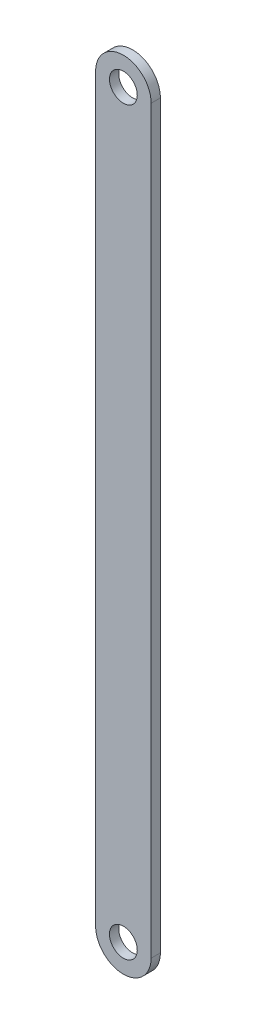
from build123d import *

# Parameters (mm, degrees)
SKETCH_1_R      = 3
EXTRUDE_1_DEPTH = 2


with BuildPart() as part:
    # 草图1 → 凸台-拉伸1 (new body)
    with BuildSketch(Plane.XY):
        with BuildLine():
            Line((6, 0), (6, -160.01))
            ThreePointArc((6, -160.01), (0, -166.01), (-6, -160.01))
            Line((-6, -160.01), (-6, 0))
            ThreePointArc((-6, 0), (0, 6), (6, 0))
        make_face()
        Circle(SKETCH_1_R, mode=Mode.SUBTRACT)
        with Locations((0, -160.01)):
            Circle(SKETCH_1_R, mode=Mode.SUBTRACT)
    extrude(amount=EXTRUDE_1_DEPTH)


solid = part.part
